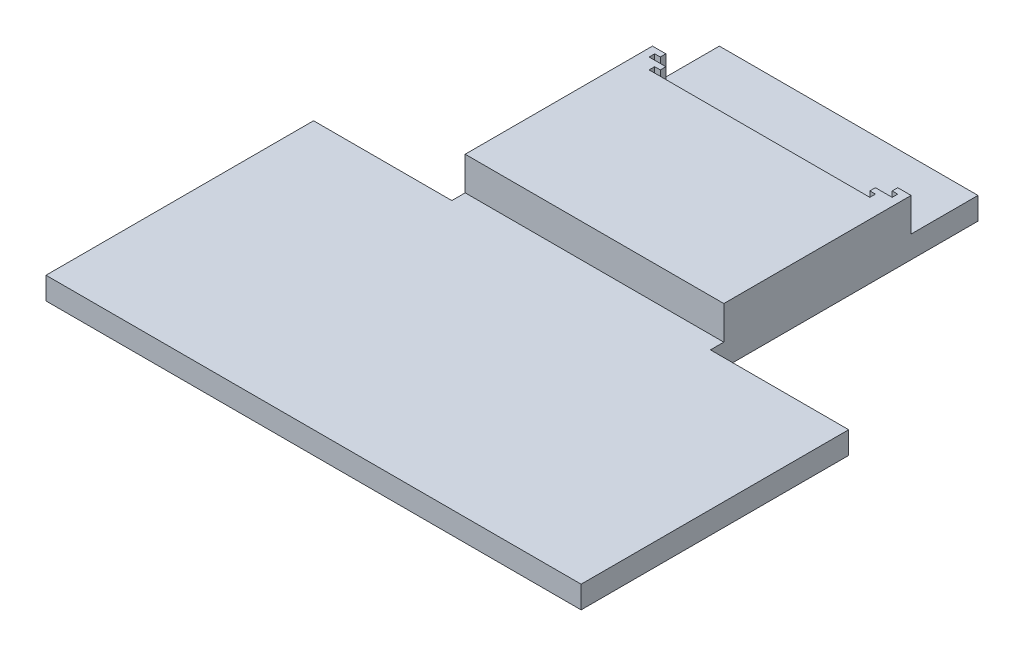
from build123d import *

# Parameters (mm, degrees)
BASE_CROQUIS_W               = 120
BASE_CROQUIS_H               = 120
BASE_SALIENTE_DEPTH          = 5
ENCAJE_RUEDAS_CROQUIS_W      = 31
ENCAJE_RUEDAS_CROQUIS_H      = 60
ENCAJE_RUEDAS_CORTAR_DEPTH   = 5
CAJA_PLACAS_CROQUIS_1_W      = 58
CAJA_PLACAS_CROQUIS_1_H      = 42
CAJA_PLACAS_CROQUIS_1_W_2    = 42
CAJA_PLACAS_CROQUIS_1_H_2    = 32
CAJA_PLACAS_SALIENTE_1_DEPTH = 5
CAJA_PLACAS_CROQUIS_2_W      = 42
CAJA_PLACAS_CROQUIS_2_H      = 32
CAJA_PLACAS_CORTAR_2_DEPTH   = 2.5
CAJA_PLACAS_CROQUIS_3_W      = 58
CAJA_PLACAS_CROQUIS_3_H      = 42
CAJA_PLACAS_SALIENTE_3_DEPTH = 2.5
CAJA_PLACAS_CORTAR_4_DEPTH   = 7.5


with BuildPart() as part:
    # Base-Croquis → Base-Saliente (new body)
    with BuildSketch(Plane(origin=(0, 0, 0), x_dir=(1, 0, 0), z_dir=(0, 1, 0))):
        Rectangle(BASE_CROQUIS_W, BASE_CROQUIS_H)
    extrude(amount=BASE_SALIENTE_DEPTH)

    # Encaje-Ruedas-Croquis → Encaje-Ruedas-Cortar (cut)
    with BuildSketch(Plane(origin=(0, 5, 0), x_dir=(1, 0, 0), z_dir=(0, 1, 0))):
        with Locations((44.5, 30)):
            Rectangle(ENCAJE_RUEDAS_CROQUIS_W, ENCAJE_RUEDAS_CROQUIS_H)
        with Locations((-44.5, 30)):
            Rectangle(ENCAJE_RUEDAS_CROQUIS_W, ENCAJE_RUEDAS_CROQUIS_H)
    extrude(amount=-ENCAJE_RUEDAS_CORTAR_DEPTH, mode=Mode.SUBTRACT)

    # Caja-Placas-Croquis-1 → Caja-Placas-Saliente-1 (add)
    with BuildSketch(Plane(origin=(0, 5, 0), x_dir=(1, 0, 0), z_dir=(0, 1, 0))):
        with Locations((0, 24)):
            Rectangle(CAJA_PLACAS_CROQUIS_1_W, CAJA_PLACAS_CROQUIS_1_H)
        with Locations((0, 24)):
            Rectangle(CAJA_PLACAS_CROQUIS_1_W_2, CAJA_PLACAS_CROQUIS_1_H_2, mode=Mode.SUBTRACT)
    extrude(amount=CAJA_PLACAS_SALIENTE_1_DEPTH)

    # Caja-Placas-Croquis-2 → Caja-Placas-Cortar-2 (cut)
    with BuildSketch(Plane(origin=(0, 5, 0), x_dir=(1, 0, 0), z_dir=(0, 1, 0))):
        with Locations((0, 24)):
            Rectangle(CAJA_PLACAS_CROQUIS_2_W, CAJA_PLACAS_CROQUIS_2_H)
    extrude(amount=-CAJA_PLACAS_CORTAR_2_DEPTH, mode=Mode.SUBTRACT)

    # Caja-Placas-Croquis-3 → Caja-Placas-Saliente-3 (add)
    with BuildSketch(Plane(origin=(0, 10, 0), x_dir=(1, 0, 0), z_dir=(0, 1, 0))):
        with Locations((0, 24)):
            Rectangle(CAJA_PLACAS_CROQUIS_3_W, CAJA_PLACAS_CROQUIS_3_H)
    extrude(amount=CAJA_PLACAS_SALIENTE_3_DEPTH)

    # Caja-Placas-Croquis-4 → Caja-Placas-Cortar-4 (cut)
    with BuildSketch(Plane(origin=(0, 12.5, 0), x_dir=(1, 0, 0), z_dir=(0, 1, 0))):
        Polygon((23.5, 42.5), (26, 42.5), (27.25, 42.5), (27.25, 43.75), (26, 43.75), (26, 45), (-26, 45), (-26, 43.75), (-27.25, 43.75), (-27.25, 42.5), (-26, 42.5), (-23.5, 42.5), (-23.5, 41.25), (-24.75, 41.25), (-24.75, 40), (-23.5, 40), (23.5, 40), (24.75, 40), (24.75, 41.25), (23.5, 41.25), align=None)
    extrude(amount=-CAJA_PLACAS_CORTAR_4_DEPTH, mode=Mode.SUBTRACT)


solid = part.part
